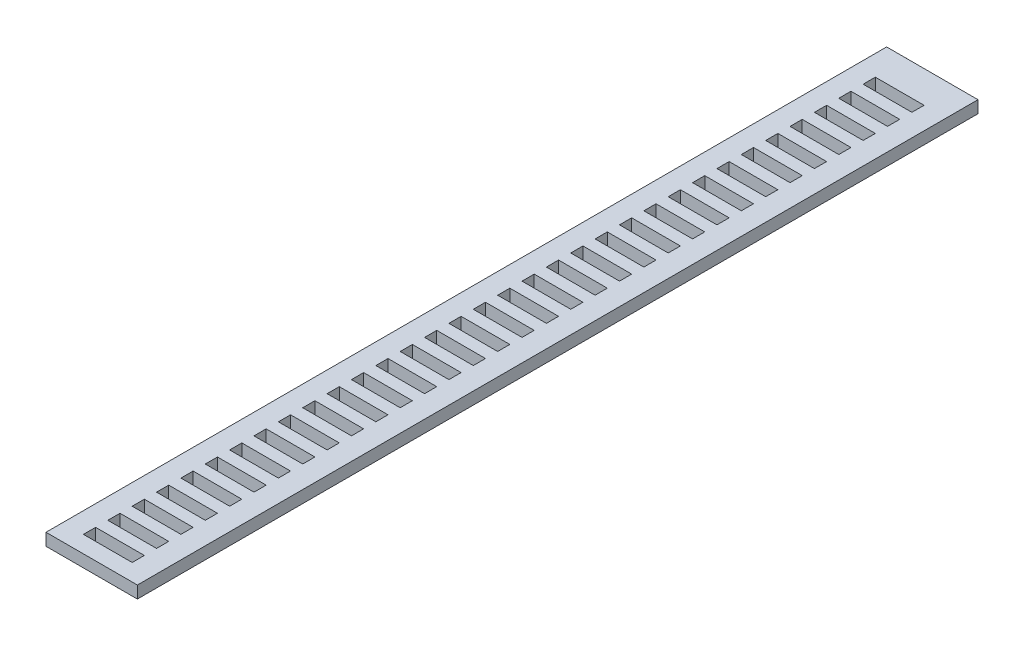
from build123d import *

# Parameters (mm, degrees)
SKETCH1_W           = 15
SKETCH1_H           = 138
BOSS_EXTRUDE1_DEPTH = 2
SKETCH2_W           = 8
SKETCH2_H           = 2
CUT_EXTRUDE1_DEPTH  = 139.827230758
LPATTERN1_COUNT     = 33
LPATTERN1_PITCH     = 4


with BuildPart() as part:
    # Sketch1 → Boss-Extrude1 (new body)
    with BuildSketch(Plane(origin=(0, 0, 0), x_dir=(1, 0, 0), z_dir=(0, 1, 0))):
        with Locations((-7.5, -69)):
            Rectangle(SKETCH1_W, SKETCH1_H)
    extrude(amount=BOSS_EXTRUDE1_DEPTH)

    # Sketch2 → Cut-Extrude1 (cut, through all)
    with BuildSketch(Plane(origin=(0, 2, 0), x_dir=(1, 0, 0), z_dir=(0, 1, 0))):
        with Locations((-7.629218666, -6.225153301)):
            Rectangle(SKETCH2_W, SKETCH2_H)
    cut_extrude1 = extrude(amount=-CUT_EXTRUDE1_DEPTH, mode=Mode.SUBTRACT)

    # LPattern1: Cut-Extrude1 ×33
    with Locations(*[(0, 0, i * LPATTERN1_PITCH) for i in range(1, LPATTERN1_COUNT)]):
        add(cut_extrude1, mode=Mode.SUBTRACT)


solid = part.part
